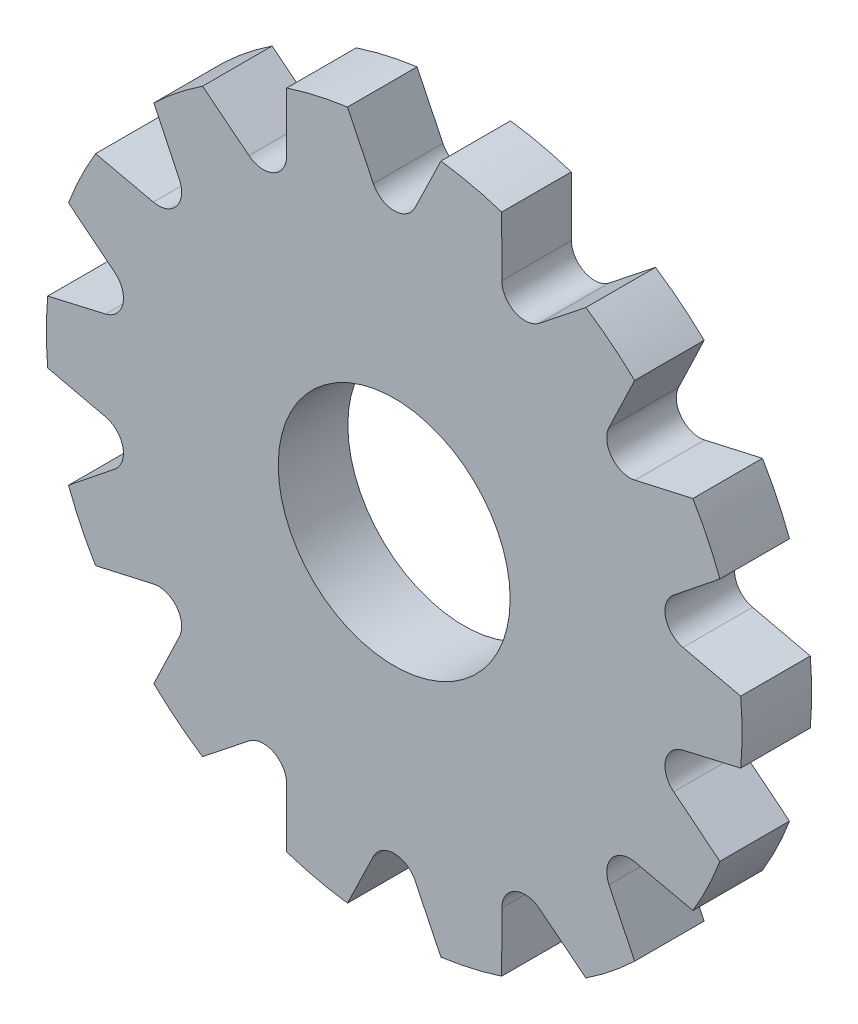
from build123d import *

# Parameters (mm, degrees)
SKETCH1_R           = 30
SKETCH1_R_2         = 10
BOSS_EXTRUDE1_DEPTH = 6
CUT_EXTRUDE1_START  = -6
CUT_EXTRUDE1_DEPTH  = 6
CIRPATTERN1_COUNT   = 14


with BuildPart() as part:
    # Sketch1 → Boss-Extrude1 (new body)
    with BuildSketch(Plane.XY):
        Circle(SKETCH1_R)
        Circle(SKETCH1_R_2, mode=Mode.SUBTRACT)
    extrude(amount=BOSS_EXTRUDE1_DEPTH)

    # Sketch2 → Cut-Extrude1 (cut)
    with BuildSketch(Plane.XY.offset(6).offset(CUT_EXTRUDE1_START)):
        with BuildLine():
            Line((-4.028701623, 29.728262028), (-1.799877236, 25.12796678))
            ThreePointArc((-1.799877236, 25.12796678), (0, 24), (1.799877236, 25.12796678))
            Line((1.799877236, 25.12796678), (4.028701623, 29.728262028))
            ThreePointArc((4.028701623, 29.728262028), (0, 30), (-4.028701623, 29.728262028))
        make_face()
    cut_extrude1 = extrude(amount=CUT_EXTRUDE1_DEPTH, mode=Mode.SUBTRACT)

    # CirPattern1: Cut-Extrude1 ×14 about axis
    cirpattern1_axis = Axis((0, 0, 0), (0, 0, 1))
    for i in range(1, CIRPATTERN1_COUNT):
        add(cut_extrude1.rotate(cirpattern1_axis, i * 360 / CIRPATTERN1_COUNT), mode=Mode.SUBTRACT)


solid = part.part
